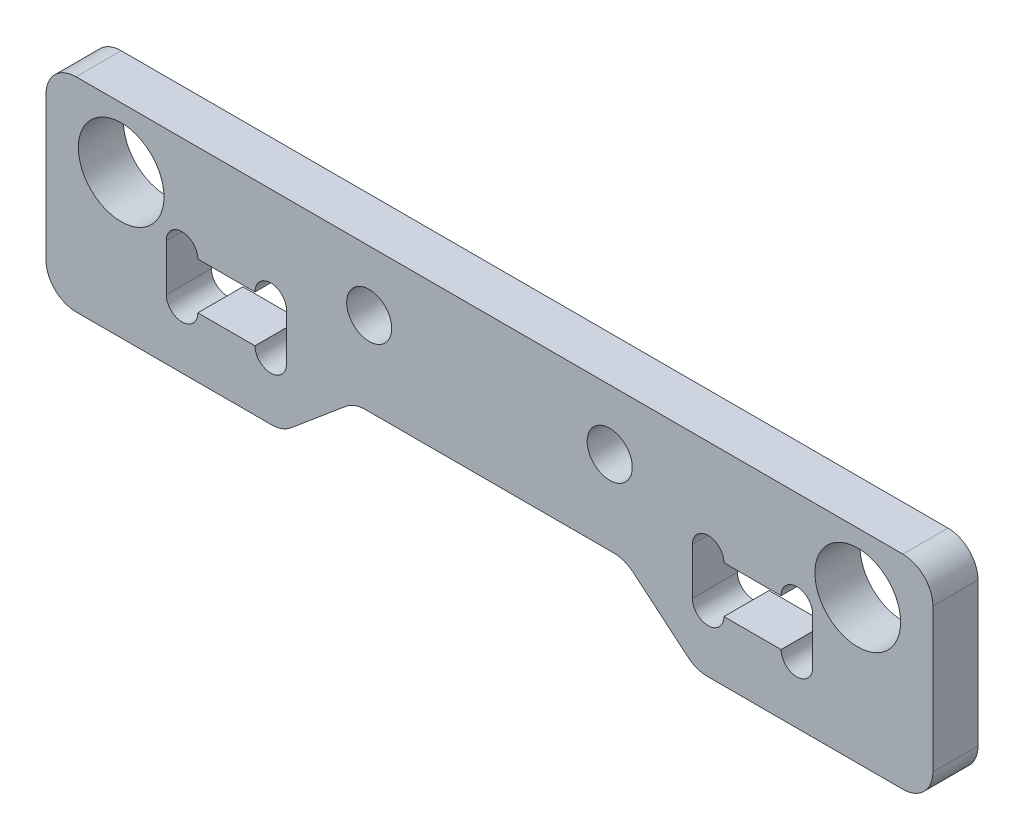
from build123d import *

# Parameters (mm, degrees)
SKETCH_1_R      = 2.85
SKETCH_1_R_2    = 1.5
EXTRUDE_1_DEPTH = 3
FILLET_1_R      = 2


with BuildPart() as part:
    # 草图1 → 凸台-拉伸1 (new body)
    with BuildSketch(Plane.XY):
        Polygon((29.5, 4), (-29.5, 4), (-29.5, -9.55), (-13.76701437, -9.55), (-9, -5.55), (9, -5.55), (13.76701437, -9.55), (29.5, -9.55), align=None)
        with BuildLine():
            Line((-15.6, -5.55), (-19.4, -5.55))
            ThreePointArc((-19.4, -5.55), (-20.45, -6.6), (-21.5, -5.55))
            Line((-21.5, -5.55), (-21.5, -2.45))
            ThreePointArc((-21.5, -2.45), (-20.45, -1.4), (-19.4, -2.45))
            Line((-19.4, -2.45), (-15.6, -2.45))
            ThreePointArc((-15.6, -2.45), (-14.55, -1.4), (-13.5, -2.45))
            Line((-13.5, -2.45), (-13.5, -5.55))
            ThreePointArc((-13.5, -5.55), (-14.55, -6.6), (-15.6, -5.55))
        make_face(mode=Mode.SUBTRACT)
        with BuildLine():
            Line((13.5, -5.55), (13.5, -2.45))
            ThreePointArc((13.5, -2.45), (14.55, -1.4), (15.6, -2.45))
            Line((15.6, -2.45), (19.4, -2.45))
            ThreePointArc((19.4, -2.45), (20.45, -1.4), (21.5, -2.45))
            Line((21.5, -2.45), (21.5, -5.55))
            ThreePointArc((21.5, -5.55), (20.45, -6.6), (19.4, -5.55))
            Line((19.4, -5.55), (15.6, -5.55))
            ThreePointArc((15.6, -5.55), (14.55, -6.6), (13.5, -5.55))
        make_face(mode=Mode.SUBTRACT)
        with Locations((-24.5, 0)):
            Circle(SKETCH_1_R, mode=Mode.SUBTRACT)
        with Locations((-8, 0)):
            Circle(SKETCH_1_R_2, mode=Mode.SUBTRACT)
        with Locations((8, 0)):
            Circle(SKETCH_1_R_2, mode=Mode.SUBTRACT)
        with Locations((24.5, 0)):
            Circle(SKETCH_1_R, mode=Mode.SUBTRACT)
    extrude(amount=EXTRUDE_1_DEPTH)

    # 圆角1
    fillet_1_edges = [part.edges().sort_by_distance(p)[0] for p in [
        (9, -5.55, 1.5),
        (-9, -5.55, 1.5),
        (-13.76701437, -9.55, 1.5),
        (-29.5, -9.55, 1.5),
        (-29.5, 4, 1.5),
        (29.5, 4, 1.5),
        (29.5, -9.55, 1.5),
        (13.76701437, -9.55, 1.5),
    ]]
    fillet(fillet_1_edges, radius=FILLET_1_R)


solid = part.part
